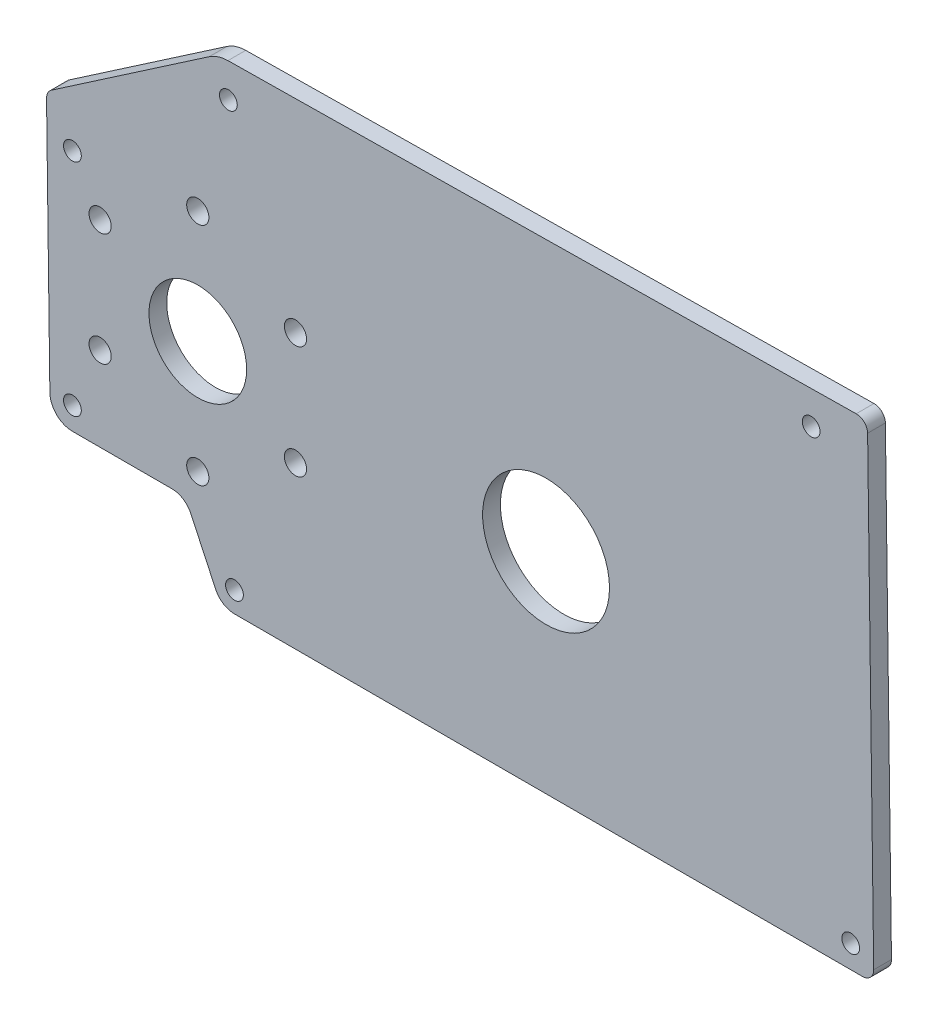
from build123d import *

# Parameters (mm, degrees)
SKETCH1_R           = 2
SKETCH1_R_2         = 14.29
SKETCH1_R_3         = 2.499999953
SKETCH1_R_4         = 11
BOSS_EXTRUDE1_DEPTH = 4


with BuildPart() as part:
    # Sketch1 → Boss-Extrude1 (new body)
    with BuildSketch(Plane.XY):
        with BuildLine():
            Line((17.566132686, -48.57422294), (-4.85811184, -48.57422294))
            ThreePointArc((-4.85811184, -48.57422294), (-8.450214288, -47.086325388), (-9.93811184, -43.49422294))
            Line((-9.93811184, -43.49422294), (-10.688835244, 13.472862597))
            ThreePointArc((-10.688835244, 13.472862597), (-10.403338368, 14.676721118), (-9.582963432, 15.602879187))
            Line((-9.582963432, 15.602879187), (-6.619834827, 17.62947485))
            Line((-6.619834827, 17.62947485), (16.768305704, 33.625508255))
            Line((16.768305704, 33.625508255), (25.964523002, 39.915148892))
            ThreePointArc((25.964523002, 39.915148892), (27.966960045, 40.890333383), (30.165836856, 41.244846678))
            Line((30.165836856, 41.244846678), (171.657580351, 43.10945257))
            ThreePointArc((171.657580351, 43.10945257), (173.463278691, 42.389235045), (174.230829536, 40.603142807))
            Line((174.230829536, 40.603142807), (175.600950315, -63.36562536))
            ThreePointArc((175.600950315, -63.36562536), (174.869016667, -65.183273725), (173.061170841, -65.939095071))
            Line((173.061170841, -65.939095071), (66.523565599, -65.939095071))
            Line((66.523565599, -65.939095071), (31.633252021, -65.939095071))
            ThreePointArc((31.633252021, -65.939095071), (29.123552435, -65.208231246), (27.398652648, -63.244185761))
            Line((27.398652648, -63.244185761), (21.800732059, -51.26913225))
            ThreePointArc((21.800732059, -51.26913225), (20.075832272, -49.305086766), (17.566132686, -48.57422294))
        make_face()
        with Locations((-4.85811184, -43.49422294)):
            Circle(SKETCH1_R, mode=Mode.SUBTRACT)
        with Locations((101.811349412, -18.649052962)):
            Circle(SKETCH1_R_2, mode=Mode.SUBTRACT)
        with Locations((31.633252021, -61.264657987)):
            Circle(SKETCH1_R, mode=Mode.SUBTRACT)
        with Locations((30.266245989, 33.625508255)):
            Circle(SKETCH1_R, mode=Mode.SUBTRACT)
        with Locations((170.426367515, -60.775756941)):
            Circle(SKETCH1_R, mode=Mode.SUBTRACT)
        with Locations((161.513898191, 35.55251649)):
            Circle(SKETCH1_R, mode=Mode.SUBTRACT)
        with Locations((-4.85811184, 6.145317428)):
            Circle(SKETCH1_R, mode=Mode.SUBTRACT)
        with Locations((23.377209906, -42.310207828)):
            Circle(SKETCH1_R_3, mode=Mode.SUBTRACT)
        with Locations((23.377209906, -16.910207828)):
            Circle(SKETCH1_R_4, mode=Mode.SUBTRACT)
        with Locations((1.38016465, -29.610207828)):
            Circle(SKETCH1_R_3, mode=Mode.SUBTRACT)
        with Locations((1.38016465, -4.210207828)):
            Circle(SKETCH1_R_3, mode=Mode.SUBTRACT)
        with Locations((23.377209906, 8.489792172)):
            Circle(SKETCH1_R_3, mode=Mode.SUBTRACT)
        with Locations((45.374255162, -4.210207828)):
            Circle(SKETCH1_R_3, mode=Mode.SUBTRACT)
        with Locations((45.374255162, -29.610207828)):
            Circle(SKETCH1_R_3, mode=Mode.SUBTRACT)
    extrude(amount=BOSS_EXTRUDE1_DEPTH)


solid = part.part
